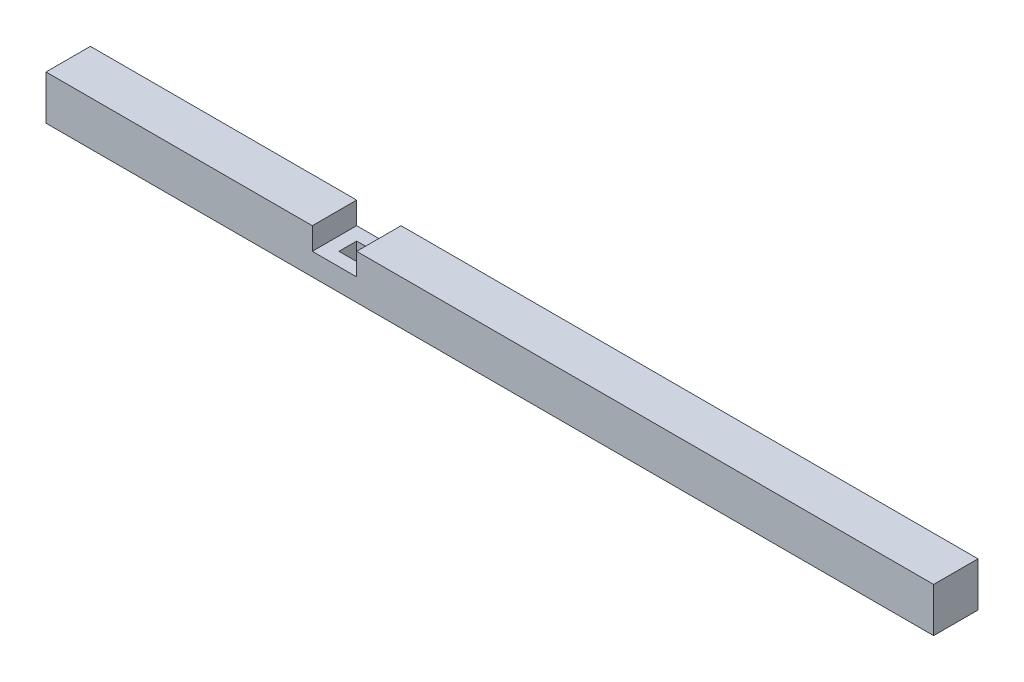
from build123d import *

# Parameters (mm, degrees)
SKETCH1_W           = 25
SKETCH1_H           = 25
BOSS_EXTRUDE1_DEPTH = 500
SKETCH2_W           = 25
SKETCH2_H           = 12.5
CUT_EXTRUDE1_DEPTH  = 502.248441394
SKETCH3_W           = 10
SKETCH3_H           = 10
CUT_EXTRUDE2_DEPTH  = 501.7806406


with BuildPart() as part:
    # Sketch1 → Boss-Extrude1 (new body)
    with BuildSketch(Plane(origin=(0, 0, 0), x_dir=(0, 0, -1), z_dir=(1, 0, 0))):
        with Locations((12.5, 12.5)):
            Rectangle(SKETCH1_W, SKETCH1_H)
    extrude(amount=BOSS_EXTRUDE1_DEPTH)

    # Sketch2 → Cut-Extrude1 (cut, through all)
    with BuildSketch(Plane.XY):
        with Locations((162.5, 18.75)):
            Rectangle(SKETCH2_W, SKETCH2_H)
    extrude(amount=-CUT_EXTRUDE1_DEPTH, mode=Mode.SUBTRACT)

    # Sketch3 → Cut-Extrude2 (cut, through all)
    with BuildSketch(Plane(origin=(0, 12.5, 0), x_dir=(1, 0, 0), z_dir=(0, 1, 0))):
        with Locations((162.5, 12.5)):
            Rectangle(SKETCH3_W, SKETCH3_H)
    extrude(amount=-CUT_EXTRUDE2_DEPTH, mode=Mode.SUBTRACT)


solid = part.part
